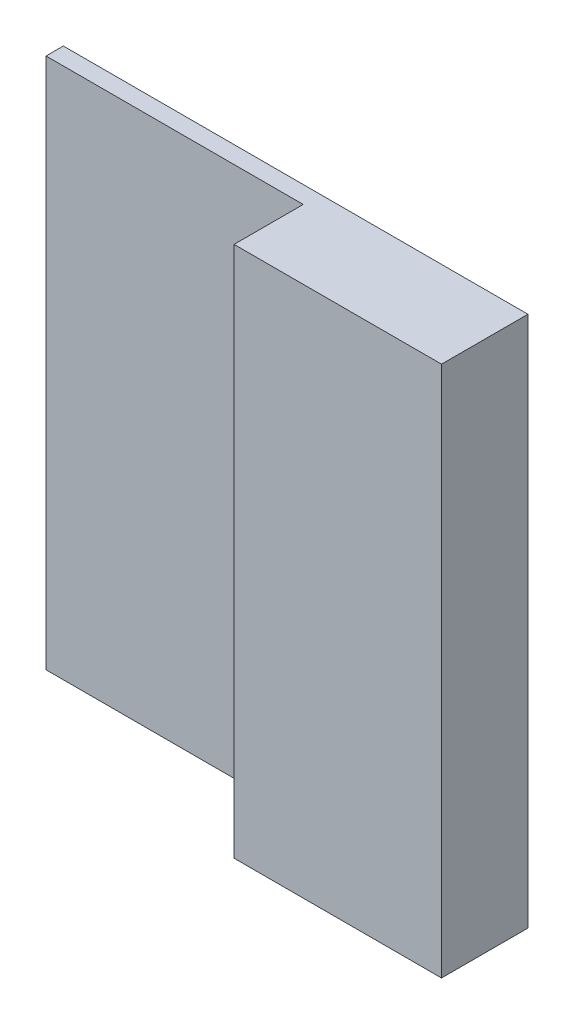
from build123d import *

# Parameters (mm, degrees)
SKETCH1_W           = 59.5
SKETCH1_H           = 4
SKETCH1_W_2         = 4
SKETCH1_W_3         = 44
BOSS_EXTRUDE1_DEPTH = 123


with BuildPart() as part:
    # Sketch1 → Boss-Extrude1 (new body)
    with BuildSketch(Plane(origin=(0, 0, 0), x_dir=(1, 0, 0), z_dir=(0, 1, 0))):
        with Locations((-77.75, 18)):
            Rectangle(SKETCH1_W, SKETCH1_H)
        with Locations((-46, 18)):
            Rectangle(SKETCH1_W_2, SKETCH1_H)
        Polygon((-48, 0), (-44, 0), (-44, 4), (-44, 16), (-48, 16), align=None)
        with Locations((-22, 2)):
            Rectangle(SKETCH1_W_3, SKETCH1_H)
        Polygon((-44, 4), (0, 4), (0, 20), (-44, 20), (-44, 16), align=None)
    extrude(amount=BOSS_EXTRUDE1_DEPTH)


solid = part.part
